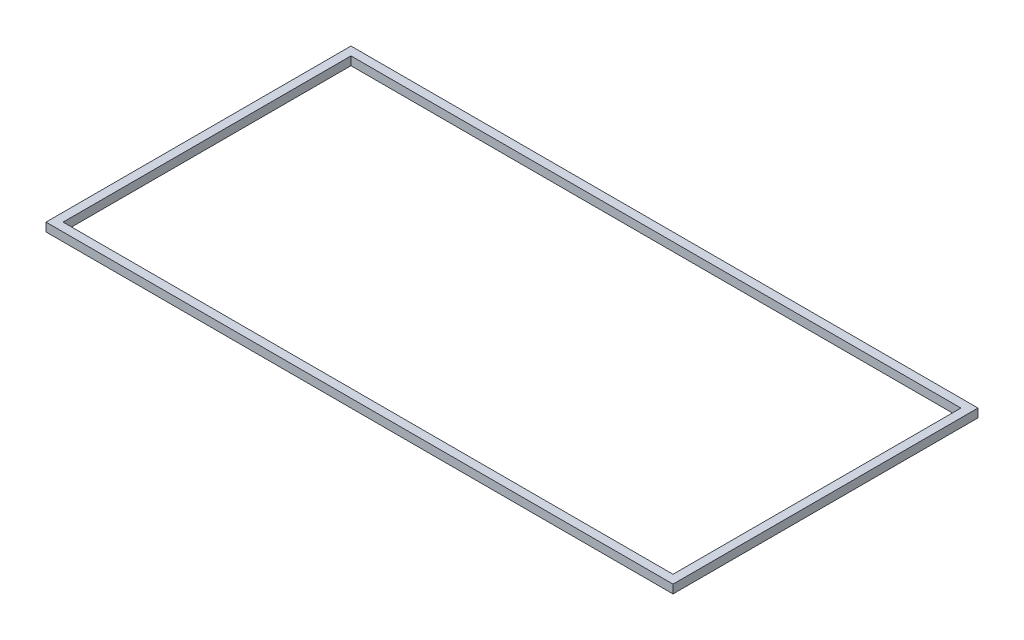
from build123d import *

# Parameters (mm, degrees)
SKETCH1_W           = 1028
SKETCH1_H           = 500
SKETCH1_W_2         = 1000
SKETCH1_H_2         = 472
BOSS_EXTRUDE1_DEPTH = 14


with BuildPart() as part:
    # Sketch1 → Boss-Extrude1 (new body)
    with BuildSketch(Plane(origin=(0, 0, 0), x_dir=(1, 0, 0), z_dir=(0, 1, 0))):
        with Locations((-514, -250)):
            Rectangle(SKETCH1_W, SKETCH1_H)
        with Locations((-514, -250)):
            Rectangle(SKETCH1_W_2, SKETCH1_H_2, mode=Mode.SUBTRACT)
    extrude(amount=BOSS_EXTRUDE1_DEPTH)


solid = part.part
